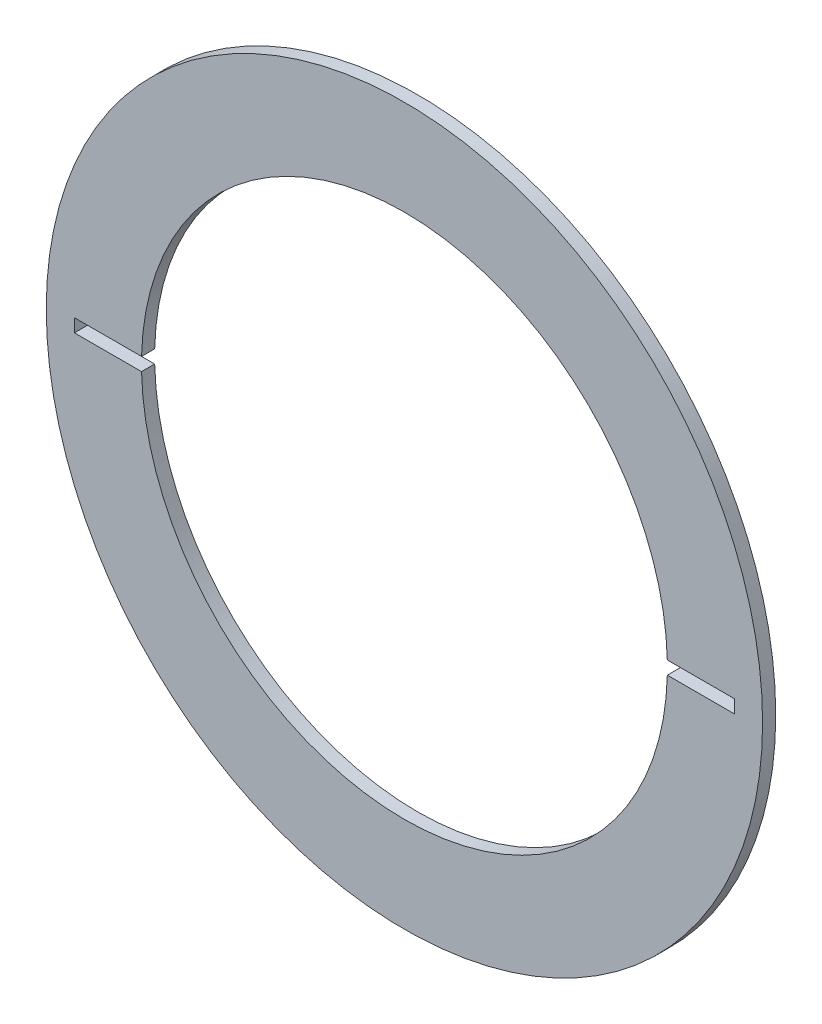
from build123d import *

# Parameters (mm, degrees)
SKETCH1_R           = 43.2435
BOSS_EXTRUDE1_DEPTH = 1.5875


with BuildPart() as part:
    # Sketch1 → Boss-Extrude1 (new body)
    with BuildSketch(Plane.XY):
        Circle(SKETCH1_R)
        with BuildLine():
            Line((39.84498, 0.79375), (39.84498, -0.79375))
            Line((39.84498, -0.79375), (31.740076574, -0.79375))
            ThreePointArc((31.740076574, -0.79375), (0, -31.75), (-31.740076574, -0.79375))
            Line((-31.740076574, -0.79375), (-39.84498, -0.79375))
            Line((-39.84498, -0.79375), (-39.84498, 0.79375))
            Line((-39.84498, 0.79375), (-31.740076574, 0.79375))
            ThreePointArc((-31.740076574, 0.79375), (0, 31.75), (31.740076574, 0.79375))
            Line((31.740076574, 0.79375), (39.84498, 0.79375))
        make_face(mode=Mode.SUBTRACT)
    extrude(amount=BOSS_EXTRUDE1_DEPTH)


solid = part.part
